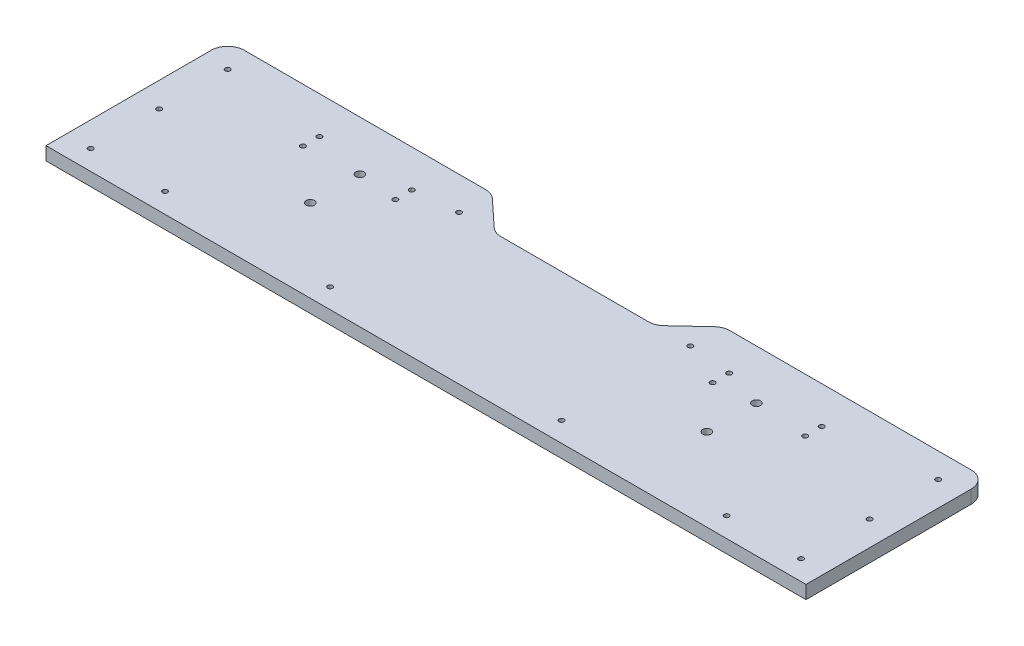
from build123d import *

# Parameters (mm, degrees)
SKETCH_2_W          = 460
SKETCH_2_H          = 110
EXTRUDE_1_DEPTH     = 8
SKETCH_4_R          = 1.5
CUT_EXTRUDE_1_DEPTH = 237.619948441
SKETCH_3_R          = 2.5
SKETCH_3_R_2        = 1.5
CUT_EXTRUDE_2_DEPTH = 237.619948441
FILLET_1_R          = 10


with BuildPart() as part:
    # 草图2 → 凸台-拉伸1 (new body)
    with BuildSketch(Plane(origin=(0, 0, 0), x_dir=(1, 0, 0), z_dir=(0, 1, 0))):
        Rectangle(SKETCH_2_W, SKETCH_2_H)
    extrude(amount=EXTRUDE_1_DEPTH)

    # 草图4 → 切除-拉伸1 (cut, through all)
    with BuildSketch(Plane(origin=(0, 8, 0), x_dir=(1, 0, 0), z_dir=(0, 1, 0))):
        with Locations(Location((-70, 35, 0), (0, 0, 270))):
            Circle(SKETCH_4_R)
        with Locations(Location((-70, -43, 0), (0, 0, 270))):
            Circle(SKETCH_4_R)
        with Locations(Location((-215, -43, 0), (0, 0, 270))):
            Circle(SKETCH_4_R)
        with Locations(Location((-215, 40, 0), (0, 0, 270))):
            Circle(SKETCH_4_R)
        with Locations(Location((-170, -43, 0), (0, 0, 270))):
            Circle(SKETCH_4_R)
        with Locations(Location((-215, -1.5, 0), (0, 0, 270))):
            Circle(SKETCH_4_R)
    cut_extrude_1 = extrude(amount=-CUT_EXTRUDE_1_DEPTH, mode=Mode.SUBTRACT)

    # 草图3 → 切除-拉伸2 (cut, through all)
    with BuildSketch(Plane(origin=(0, 8, 0), x_dir=(1, 0, 0), z_dir=(0, 1, 0))):
        with Locations(Location((-120, 25, 0), (0, 0, 270))):
            Circle(SKETCH_3_R)
        with Locations(Location((-120, -5, 0), (0, 0, 270))):
            Circle(SKETCH_3_R)
        with Locations(Location((-152, 32.5, 0), (0, 0, 270))):
            Circle(SKETCH_3_R_2)
        with Locations(Location((-152, 22.5, 0), (0, 0, 270))):
            Circle(SKETCH_3_R_2)
        with Locations(Location((-96, 32.5, 0), (0, 0, 270))):
            Circle(SKETCH_3_R_2)
        with Locations(Location((-96, 22.5, 0), (0, 0, 270))):
            Circle(SKETCH_3_R_2)
        Polygon((-70, 55), (-48.5526258, 35), (48.5526258, 35), (70, 55), align=None)
    cut_extrude_2 = extrude(amount=-CUT_EXTRUDE_2_DEPTH, mode=Mode.SUBTRACT)

    # 镜向1: 切除-拉伸1, 切除-拉伸2 across plane
    add(cut_extrude_1.mirror(Plane(origin=(0, 0, 0), x_dir=(0, 0, 1), z_dir=(1, 0, 0))), mode=Mode.SUBTRACT)
    add(cut_extrude_2.mirror(Plane(origin=(0, 0, 0), x_dir=(0, 0, 1), z_dir=(1, 0, 0))), mode=Mode.SUBTRACT)

    # 圆角1
    fillet_1_edges = [part.edges().sort_by_distance(p)[0] for p in [
        (-70, 4, -55),
        (70, 4, -55),
        (48.5526258, 4, -35),
        (-48.5526258, 4, -35),
        (-230, 4, -55),
        (230, 4, -55),
    ]]
    fillet(fillet_1_edges, radius=FILLET_1_R)


solid = part.part
